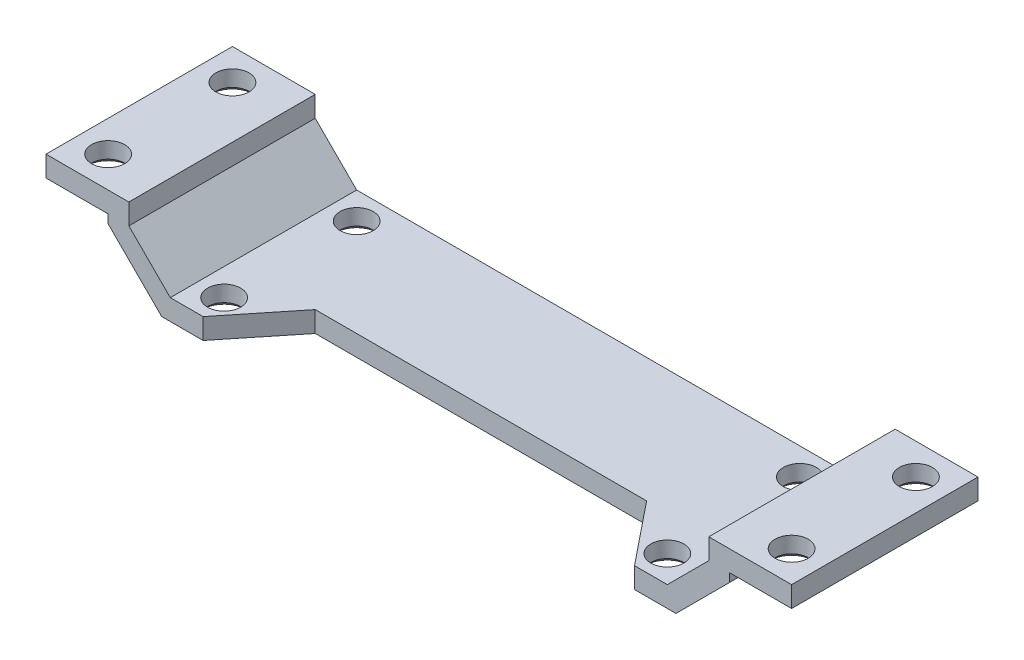
from build123d import *

# Parameters (mm, degrees)
EXTRUDE_1_DEPTH             = 9
CUT_EXTRUDE_1_DEPTH         = 21.518284529
HOLE_WIZARD_M2_2_AT_2_COUNT = 2
HOLE_WIZARD_M2_2_AT_2_PITCH = 6
HOLE_WIZARD_M2_2_AT_3_COUNT = 2
HOLE_WIZARD_M2_2_AT_3_PITCH = 33
HOLE_WIZARD_M2_2_AT_4_COUNT = 2
HOLE_WIZARD_M2_2_AT_4_PITCH = 33.541019662
HOLE_WIZARD_M2_3_AT_2_COUNT = 2
HOLE_WIZARD_M2_3_AT_2_PITCH = 6.4
HOLE_WIZARD_M2_3_AT_3_COUNT = 2
HOLE_WIZARD_M2_3_AT_3_PITCH = 22.336517186
HOLE_WIZARD_M2_3_AT_4_COUNT = 2
HOLE_WIZARD_M2_3_AT_4_PITCH = 21.4


with BuildPart() as part:
    # 草图1 → 凸台-拉伸1 (new body)
    with BuildSketch(Plane.XY):
        Polygon((-12, 0), (12, 0), (14, 2), (14, 3), (18, 3), (18, 2), (15, 2), (15, 1.585786438), (12.414213562, -1), (-12.414213562, -1), (-15, 1.585786438), (-15, 2), (-18, 2), (-18, 3), (-14, 3), (-14, 2), align=None)
    extrude(amount=EXTRUDE_1_DEPTH)

    # 草图2 → 切除-拉伸1 (cut, through all)
    with BuildSketch(Plane.XZ.offset(1)):
        Polygon((-10.414213562, 9), (-8, 6), (8, 6), (10.414213562, 9), align=None)
    extrude(amount=-CUT_EXTRUDE_1_DEPTH, mode=Mode.SUBTRACT)

    # 草图7 → M2 螺纹孔2 (revolve, cut)
    with BuildSketch(Plane(origin=(-16.5, 2, 7.5), x_dir=(0, 0, -1), z_dir=(1, 0, 0))):
        Polygon((0, 0), (0, 1), (0.8, 1), (0.8, 0.225), (1.025, 0), align=None)
    hole_wizard_m2_2 = revolve(axis=Axis((-16.5, -4.35, 7.5), (0, 1, 0)), mode=Mode.SUBTRACT)

    # M2 螺纹孔2 at 2: M2 螺纹孔2 ×2
    with Locations(*[(0, 0, -i * HOLE_WIZARD_M2_2_AT_2_PITCH) for i in range(1, HOLE_WIZARD_M2_2_AT_2_COUNT)]):
        add(hole_wizard_m2_2, mode=Mode.SUBTRACT)

    # M2 螺纹孔2 at 3: M2 螺纹孔2 ×2
    with Locations(*[(i * HOLE_WIZARD_M2_2_AT_3_PITCH, 0, 0) for i in range(1, HOLE_WIZARD_M2_2_AT_3_COUNT)]):
        add(hole_wizard_m2_2, mode=Mode.SUBTRACT)

    # M2 螺纹孔2 at 4: M2 螺纹孔2 ×2
    with Locations(*[Vector(0.9838699100999075, 0, -0.17888543819998318) * (i * HOLE_WIZARD_M2_2_AT_4_PITCH) for i in range(1, HOLE_WIZARD_M2_2_AT_4_COUNT)]):
        add(hole_wizard_m2_2, mode=Mode.SUBTRACT)

    # 草图10 → M2 螺纹孔3 (revolve, cut)
    with BuildSketch(Plane(origin=(-10.7, -1, 7.7), x_dir=(0, 0, -1), z_dir=(1, 0, 0))):
        Polygon((0, 0), (0, 1), (0.8, 1), (0.8, 0.225), (1.025, 0), align=None)
    hole_wizard_m2_3 = revolve(axis=Axis((-10.7, -7.35, 7.7), (0, 1, 0)), mode=Mode.SUBTRACT)

    # M2 螺纹孔3 at 2: M2 螺纹孔3 ×2
    with Locations(*[(0, 0, -i * HOLE_WIZARD_M2_3_AT_2_PITCH) for i in range(1, HOLE_WIZARD_M2_3_AT_2_COUNT)]):
        add(hole_wizard_m2_3, mode=Mode.SUBTRACT)

    # M2 螺纹孔3 at 3: M2 螺纹孔3 ×2
    with Locations(*[Vector(0.9580723718836152, 0, -0.28652631682500634) * (i * HOLE_WIZARD_M2_3_AT_3_PITCH) for i in range(1, HOLE_WIZARD_M2_3_AT_3_COUNT)]):
        add(hole_wizard_m2_3, mode=Mode.SUBTRACT)

    # M2 螺纹孔3 at 4: M2 螺纹孔3 ×2
    with Locations(*[(i * HOLE_WIZARD_M2_3_AT_4_PITCH, 0, 0) for i in range(1, HOLE_WIZARD_M2_3_AT_4_COUNT)]):
        add(hole_wizard_m2_3, mode=Mode.SUBTRACT)


solid = part.part
